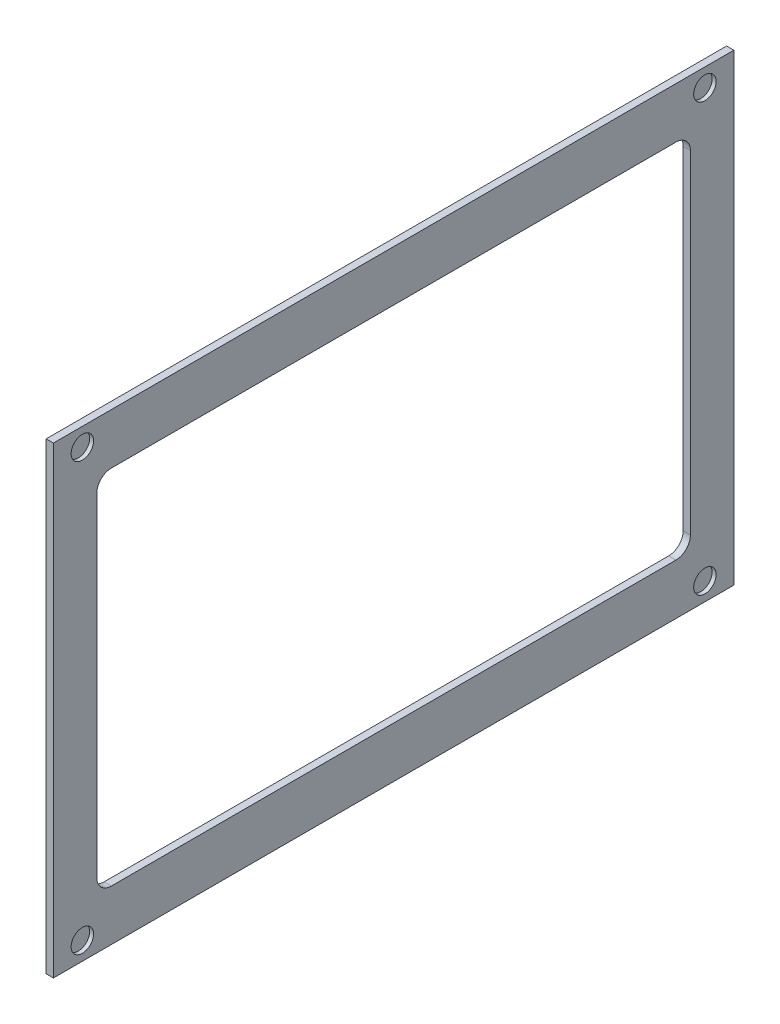
from build123d import *

# Parameters (mm, degrees)
SKETCH_1_W          = 188
SKETCH_1_H          = 128
EXTRUDE_1_DEPTH     = 2
SKETCH_8_R          = 3.1
CUT_EXTRUDE_5_DEPTH = 1.1
SKETCH_11_W         = 164
SKETCH_11_H         = 100
CUT_EXTRUDE_8_DEPTH = 10
FILLET_2_R          = 4


with BuildPart() as part:
    # 草图1 → 凸台-拉伸1 (new body)
    with BuildSketch(Plane(origin=(0, 0, 0), x_dir=(0, 0, -1), z_dir=(1, 0, 0))):
        with Locations((-39.672025676, 38.239203457)):
            Rectangle(SKETCH_1_W, SKETCH_1_H)
    extrude(amount=EXTRUDE_1_DEPTH)

    # 草图8 → 切除-拉伸5 (cut)
    with BuildSketch(Plane(origin=(2, 0, 0), x_dir=(0, 0, -1), z_dir=(1, 0, 0))):
        with Locations((-125.672025676, 97.239203457)):
            Circle(SKETCH_8_R)
        with Locations((46.327974324, 97.239203457)):
            Circle(SKETCH_8_R)
        with Locations((-125.672025676, -20.760796543)):
            Circle(SKETCH_8_R)
        with Locations((46.327974324, -20.760796543)):
            Circle(SKETCH_8_R)
    extrude(amount=-CUT_EXTRUDE_5_DEPTH, mode=Mode.SUBTRACT)

    # 草图11 → 切除-拉伸8 (cut)
    with BuildSketch(Plane.ZY):
        with Locations((39.672025676, 38.239203457)):
            Rectangle(SKETCH_11_W, SKETCH_11_H)
    extrude(amount=-CUT_EXTRUDE_8_DEPTH, mode=Mode.SUBTRACT)

    # 圆角2
    fillet_2_edges = [part.edges().sort_by_distance(p)[0] for p in [
        (1, 88.239203457, 121.672025676),
        (1, -11.760796543, 121.672025676),
        (1, -11.760796543, -42.327974324),
        (1, 88.239203457, -42.327974324),
    ]]
    fillet(fillet_2_edges, radius=FILLET_2_R)


solid = part.part
